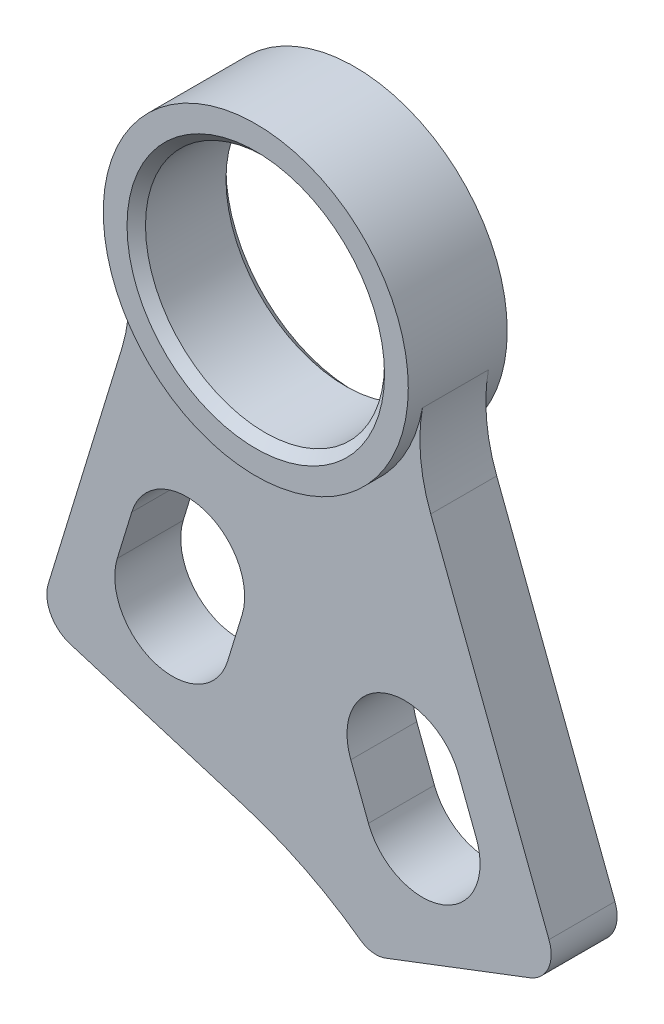
from build123d import *

# Parameters (mm, degrees)
SKETCH1_R           = 11.5062
BOSS_EXTRUDE2_DEPTH = 4.7625
BOSS_EXTRUDE3_DEPTH = 3.175
FILLET1_R           = 3.175
CHAMFER1_SIZE       = 0.889


with BuildPart() as part:
    # Sketch1 → Boss-Extrude2 (new, symmetric)
    with BuildSketch(Plane.XY):
        with BuildLine():
            ThreePointArc((14.454574535, -2.569612511), (-0.50143503, 14.672634268), (-14.245423001, -3.550430532))
            ThreePointArc((-14.245423001, -3.550430532), (0.50143503, -14.672634268), (14.454574535, -2.569612511))
        make_face()
        Circle(SKETCH1_R, mode=Mode.SUBTRACT)
    extrude(amount=BOSS_EXTRUDE2_DEPTH, both=True)

    # Sketch1<4> → Boss-Extrude3 (add, symmetric)
    with BuildSketch(Plane.XY):
        with BuildLine():
            ThreePointArc((-14.245423001, -3.550430532), (-13.779661889, -7.805545679), (-14.467705296, -12.030416635))
            Line((-14.467705296, -12.030416635), (-22.491098066, -38.27714082))
            Line((-22.491098066, -38.27714082), (-2.755140848, -44.310249384))
            ThreePointArc((-2.755140848, -44.310249384), (3.08819115, -46.639517528), (8.468620942, -49.898504209))
            ThreePointArc((8.468620942, -49.898504209), (9.641965512, -50.366054867), (10.896408583, -50.218699247))
            Line((10.896408583, -50.218699247), (27.771706227, -43.770411636))
            Line((27.771706227, -43.770411636), (15.255266531, -11.014638624))
            ThreePointArc((15.255266531, -11.014638624), (14.280396638, -6.846597475), (14.454574535, -2.569612511))
            ThreePointArc((14.454574535, -2.569612511), (0.50143503, -14.672634268), (-14.245423001, -3.550430532))
        make_face()
        with BuildLine():
            ThreePointArc((-4.293038232, -33.050014953), (-11.230863635, -36.739243436), (-14.920092118, -29.801418033))
            Line((-14.920092118, -29.801418033), (-13.527836296, -25.246966368))
            ThreePointArc((-13.527836296, -25.246966368), (-6.590010893, -21.557737884), (-2.900782409, -28.495563287))
            Line((-2.900782409, -28.495563287), (-4.293038232, -33.050014953))
        make_face(mode=Mode.SUBTRACT)
        with BuildLine():
            ThreePointArc((19.639727055, -35.831335962), (16.432751029, -43.004838098), (9.259248893, -39.797862073))
            Line((9.259248893, -39.797862073), (7.559309131, -35.349085718))
            ThreePointArc((7.559309131, -35.349085718), (10.766285157, -28.175583582), (17.939787293, -31.382559607))
            Line((17.939787293, -31.382559607), (19.639727055, -35.831335962))
        make_face(mode=Mode.SUBTRACT)
    extrude(amount=BOSS_EXTRUDE3_DEPTH, both=True)

    # Fillet1
    fillet1_edges = [part.edges().sort_by_distance(p)[0] for p in [
        (-22.491098066, -38.27714082, 0),
        (27.771706227, -43.770411636, 0),
    ]]
    fillet(fillet1_edges, radius=FILLET1_R)

    # Chamfer1
    chamfer1_edges = [part.edges().sort_by_distance(p)[0] for p in [
        (-11.5062, 0, -4.7625),
        (-11.5062, 0, 4.7625),
    ]]
    chamfer(chamfer1_edges, length=CHAMFER1_SIZE)


solid = part.part
